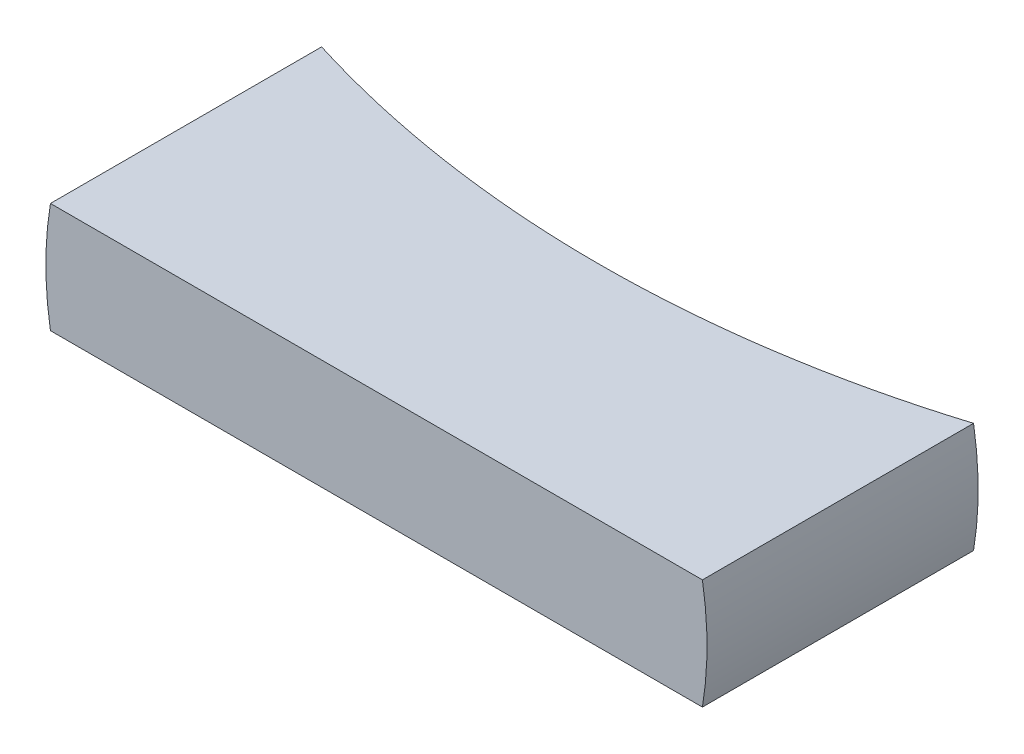
from build123d import *

# Parameters (mm, degrees)
SKETCH1_R               = 3
BOSS_EXTRUDE1_DEPTH     = 12
CUT_EXTRUDE1_DEPTH      = 30
CUT_EXTRUDE1_DEPTH_BACK = 20
SKETCH4_OUTSIDE_W       = 9.766
SKETCH4_OUTSIDE_H       = 9.766
SKETCH4_OUTSIDE_W_2     = 17.421605186
SKETCH4_OUTSIDE_H_2     = 1


with BuildPart() as part:
    # Sketch1 → Boss-Extrude1 (new body)
    with BuildSketch(Plane.XY):
        Circle(SKETCH1_R)
    extrude(amount=BOSS_EXTRUDE1_DEPTH)

    # Sketch3 → Cut-Revolve1 (revolve, cut)
    with BuildSketch(Plane(origin=(0, 0, 0), x_dir=(1, 0, 0), z_dir=(0, 1, 0))):
        with BuildLine():
            Line((0, -10.0001), (0, 10.0001))
            ThreePointArc((0, 10.0001), (-10.0001, 0), (0, -10.0001))
        make_face()
    revolve(axis=Axis((0, 0, 10.0001), (0, 0, -1)), mode=Mode.SUBTRACT)

    # Sketch4 outside → Cut-Extrude1 (cut, two sides: drawn at the far end of the back side and taken through both)
    with BuildSketch(Plane.XY.offset(-CUT_EXTRUDE1_DEPTH_BACK)):
        Rectangle(SKETCH4_OUTSIDE_W, SKETCH4_OUTSIDE_H)
        Rectangle(SKETCH4_OUTSIDE_W_2, SKETCH4_OUTSIDE_H_2, mode=Mode.SUBTRACT)
    extrude(amount=CUT_EXTRUDE1_DEPTH + CUT_EXTRUDE1_DEPTH_BACK, mode=Mode.SUBTRACT)


solid = part.part
